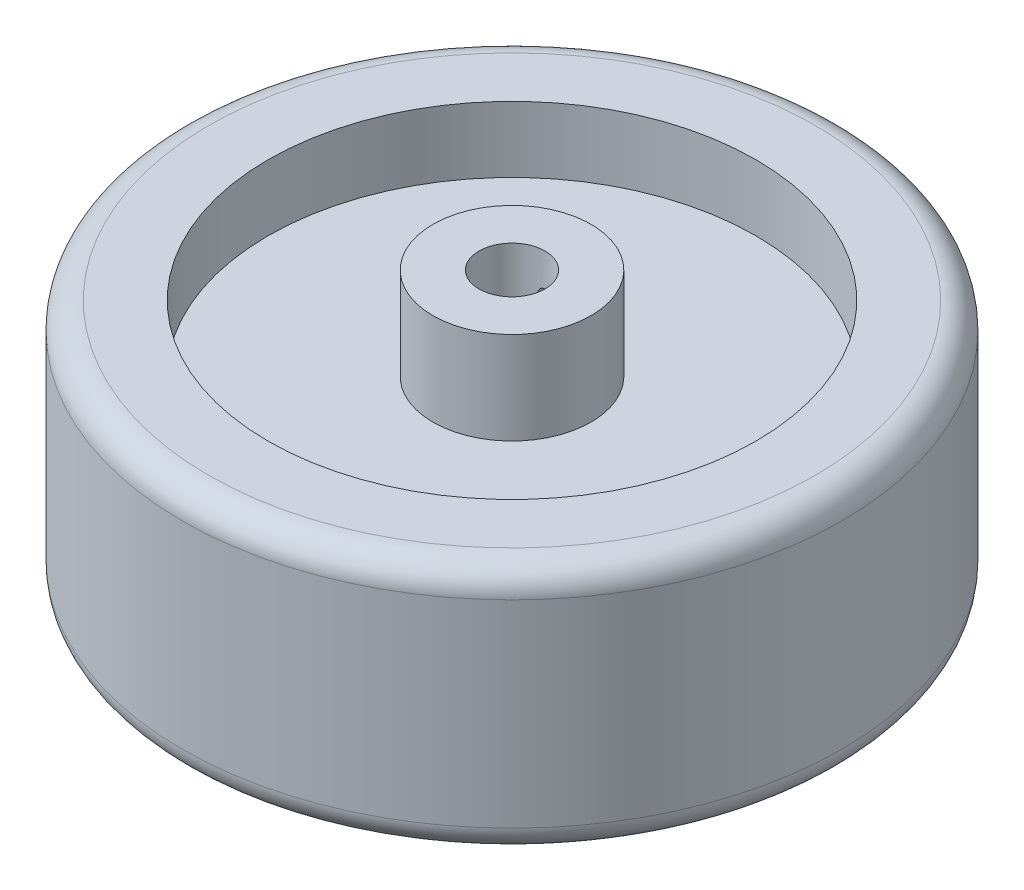
from build123d import *

# Parameters (mm, degrees)
SKETCH1_R           = 50
EXTRUDE1_DEPTH      = 38
EXTRUDE2_DEPTH      = 4
EXTRUDE2_DEPTH_BACK = 42
SKETCH2_R           = 12
SKETCH3_R           = 5
EXTRUDE3_DEPTH      = 77
SKETCH4_R           = 37
SKETCH4_R_2         = 12
EXTRUDE4_DEPTH      = 10
EXTRUDE6_START      = -10
SKETCH5_R           = 37
SKETCH5_R_2         = 12
EXTRUDE6_DEPTH      = 10
FILLET1_R           = 4
SKETCH6_R           = 1
EXTRUDE7_DEPTH      = 12


with BuildPart() as part:
    # Sketch1 → Extrude1 (new body)
    with BuildSketch(Plane(origin=(0, 0, 0), x_dir=(1, 0, 0), z_dir=(0, 1, 0))):
        with Locations(Location((0, 0, 0), (0, 0, 270))):
            Circle(SKETCH1_R)
    extrude(amount=EXTRUDE1_DEPTH)

    # Sketch2 → Extrude2 (add, two sides: drawn at the far end of the back side and taken through both)
    with BuildSketch(Plane.XZ.offset(-EXTRUDE2_DEPTH_BACK)):
        with Locations(Location((0, 0, 0), (0, 0, 270))):
            Circle(SKETCH2_R)
    extrude(amount=EXTRUDE2_DEPTH + EXTRUDE2_DEPTH_BACK)

    # Sketch3 → Extrude3 (cut)
    with BuildSketch(Plane.XZ.offset(4)):
        with Locations(Location((0, 0, 0), (0, 0, 270))):
            Circle(SKETCH3_R)
    extrude(amount=-EXTRUDE3_DEPTH, mode=Mode.SUBTRACT)

    # Sketch4 → Extrude4 (cut)
    with BuildSketch(Plane.XZ):
        with Locations(Location((0, 0, 0), (0, 0, 270))):
            Circle(SKETCH4_R)
        with Locations(Location((0, 0, 0), (0, 0, 270))):
            Circle(SKETCH4_R_2, mode=Mode.SUBTRACT)
    extrude(amount=-EXTRUDE4_DEPTH, mode=Mode.SUBTRACT)

    # Sketch5 → Extrude6 (cut)
    with BuildSketch(Plane(origin=(0, 38, 0), x_dir=(1, 0, 0), z_dir=(0, 1, 0)).offset(EXTRUDE6_START)):
        with Locations(Location((0, 0, 0), (0, 0, 90))):
            Circle(SKETCH5_R)
        with Locations(Location((0, 0, 0), (0, 0, 90))):
            Circle(SKETCH5_R_2, mode=Mode.SUBTRACT)
    extrude(amount=EXTRUDE6_DEPTH, mode=Mode.SUBTRACT)

    # Fillet1
    fillet1_edges = [part.edges().sort_by_distance(p)[0] for p in [
        (0, 0, -50),
        (0, 38, -50),
    ]]
    fillet(fillet1_edges, radius=FILLET1_R)

    # Sketch6 → Extrude7 (cut)
    with BuildSketch(Plane.XY):
        with Locations(Location((0, 36, 0), (0, 0, 90))):
            Circle(SKETCH6_R)
    extrude(amount=-EXTRUDE7_DEPTH, mode=Mode.SUBTRACT)


solid = part.part
